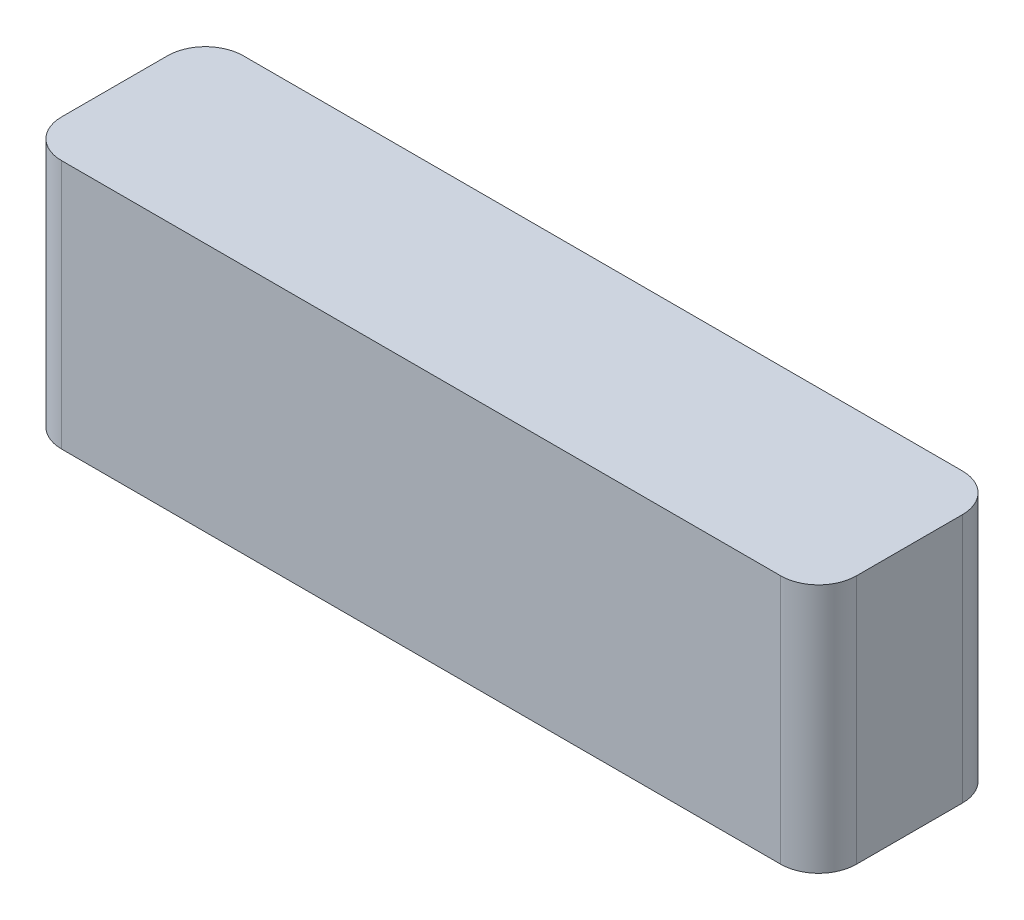
from build123d import *

# Parameters (mm, degrees)
SKETCH2_W           = 105
SKETCH2_H           = 24
BOSS_EXTRUDE1_DEPTH = 33
FILLET1_R           = 5


with BuildPart() as part:
    # Sketch2 → Boss-Extrude1 (new body)
    with BuildSketch(Plane(origin=(0, 0, 0), x_dir=(1, 0, 0), z_dir=(0, 1, 0))):
        Rectangle(SKETCH2_W, SKETCH2_H)
    extrude(amount=BOSS_EXTRUDE1_DEPTH)

    # Fillet1
    fillet1_edges = [part.edges().sort_by_distance(p)[0] for p in [
        (52.5, 16.5, 12),
        (-52.5, 16.5, 12),
        (-52.5, 16.5, -12),
        (52.5, 16.5, -12),
    ]]
    fillet(fillet1_edges, radius=FILLET1_R)


solid = part.part
